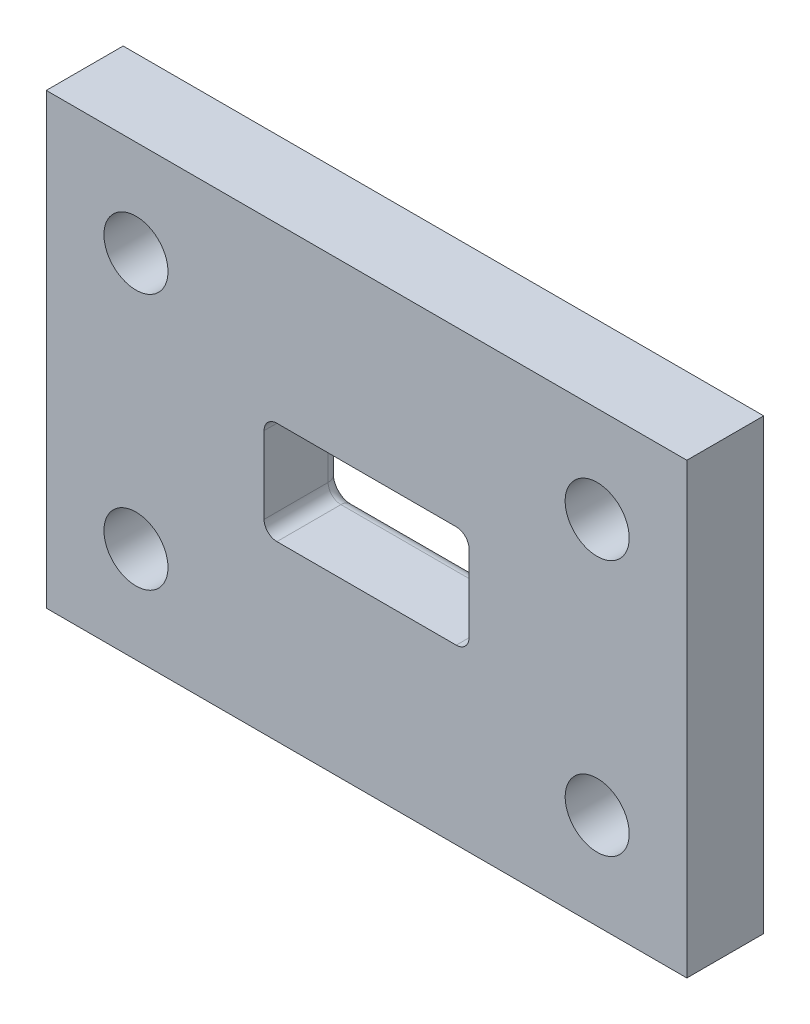
from build123d import *

# Parameters (mm, degrees)
SKETCH1_W           = 50
SKETCH1_H           = 35
SKETCH1_R           = 2.5
BOSS_EXTRUDE1_DEPTH = 6
CUT_EXTRUDE1_DEPTH  = 1
FILLET3_R           = 1


with BuildPart() as part:
    # Sketch1 → Boss-Extrude1 (new body)
    with BuildSketch(Plane.XY):
        Rectangle(SKETCH1_W, SKETCH1_H)
        with Locations((18, 10)):
            Circle(SKETCH1_R, mode=Mode.SUBTRACT)
        with Locations(Location((18, -10, 0), (0, 0, 180))):
            Circle(SKETCH1_R, mode=Mode.SUBTRACT)
        with Locations(Location((-18, 10, 0), (0, 0, 180))):
            Circle(SKETCH1_R, mode=Mode.SUBTRACT)
        with Locations((-18, -10)):
            Circle(SKETCH1_R, mode=Mode.SUBTRACT)
        with BuildLine():
            Line((-7, 4), (7, 4))
            ThreePointArc((7, 4), (7.707106781, 3.707106781), (8, 3))
            Line((8, 3), (8, -3))
            ThreePointArc((8, -3), (7.707106781, -3.707106781), (7, -4))
            Line((7, -4), (-7, -4))
            ThreePointArc((-7, -4), (-7.707106781, -3.707106781), (-8, -3))
            Line((-8, -3), (-8, 3))
            ThreePointArc((-8, 3), (-7.707106781, 3.707106781), (-7, 4))
        make_face(mode=Mode.SUBTRACT)
    extrude(amount=BOSS_EXTRUDE1_DEPTH)

    # Sketch2 → Cut-Extrude1 (cut)
    with BuildSketch(Plane.XY):
        with BuildLine():
            Line((-10.8, -11), (10.8, -11))
            ThreePointArc((10.8, -11), (10.941421356, -10.941421356), (11, -10.8))
            Line((11, -10.8), (11, 10.8))
            ThreePointArc((11, 10.8), (10.941421356, 10.941421356), (10.8, 11))
            Line((10.8, 11), (-10.8, 11))
            ThreePointArc((-10.8, 11), (-10.941421356, 10.941421356), (-11, 10.8))
            Line((-11, 10.8), (-11, -10.8))
            ThreePointArc((-11, -10.8), (-10.941421356, -10.941421356), (-10.8, -11))
        make_face()
        with BuildLine():
            Line((-9.8, -10), (9.8, -10))
            ThreePointArc((9.8, -10), (9.941421356, -9.941421356), (10, -9.8))
            Line((10, -9.8), (10, 9.8))
            ThreePointArc((10, 9.8), (9.941421356, 9.941421356), (9.8, 10))
            Line((9.8, 10), (-9.8, 10))
            ThreePointArc((-9.8, 10), (-9.941421356, 9.941421356), (-10, 9.8))
            Line((-10, 9.8), (-10, -9.8))
            ThreePointArc((-10, -9.8), (-9.941421356, -9.941421356), (-9.8, -10))
        make_face(mode=Mode.SUBTRACT)
    extrude(amount=CUT_EXTRUDE1_DEPTH, mode=Mode.SUBTRACT)

    # Fillet3
    fillet3_edges = [part.edges().sort_by_distance(p)[0] for p in [
        (-7.707106781, 3.707106781, 0),
        (-8, 0, 0),
        (-7.707106781, -3.707106781, 0),
        (0, -4, 0),
        (7.707106781, -3.707106781, 0),
        (8, 0, 0),
        (0, 4, 0),
        (7.707106781, 3.707106781, 0),
    ]]
    fillet(fillet3_edges, radius=FILLET3_R)


solid = part.part
